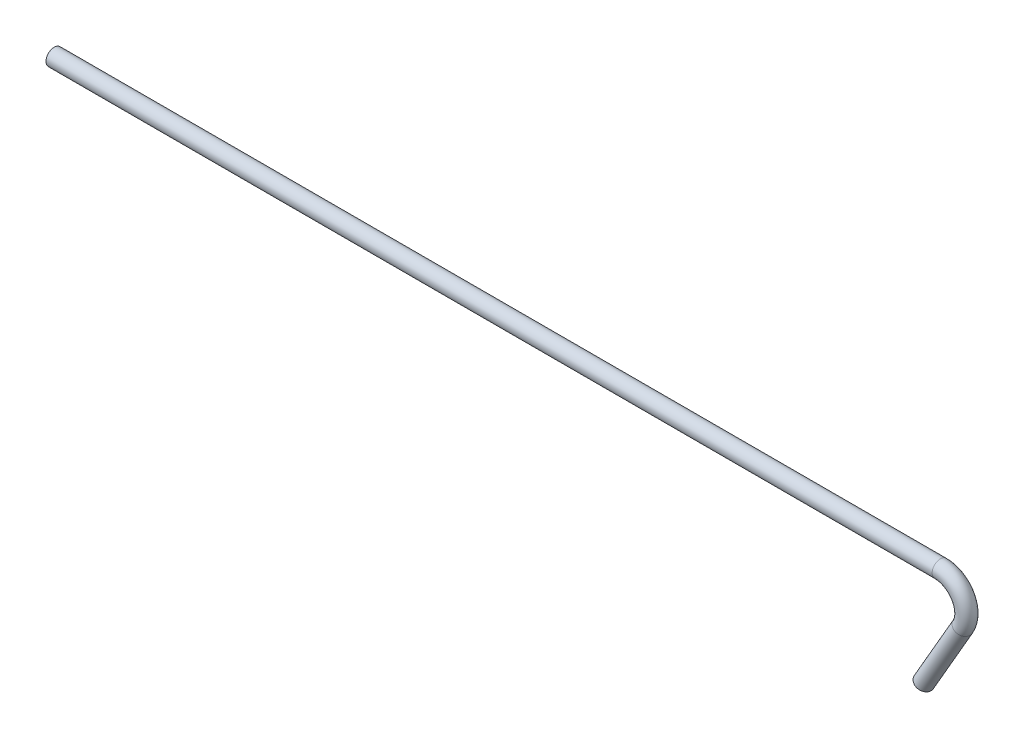
from build123d import *

# Parameters (mm, degrees)
SKETCH2_R = 2


with BuildPart() as part:
    # Sweep1: sweep along a path in Sketch1
    with BuildLine(Plane.XY) as sweep1_path:
        Line((0, 0), (215.9, 0))
        ThreePointArc((215.9, 0), (221.399261314, -3.175), (221.399261314, -9.525))
        Line((221.399261314, -9.525), (211.899261314, -25.979482672))
    # Sketch2 → Sweep1 (sweep)
    with BuildSketch(Plane(origin=(0, 0, 0), x_dir=(0, 0, -1), z_dir=(1, 0, 0))):
        Circle(SKETCH2_R)
    sweep(path=sweep1_path.line)


solid = part.part
